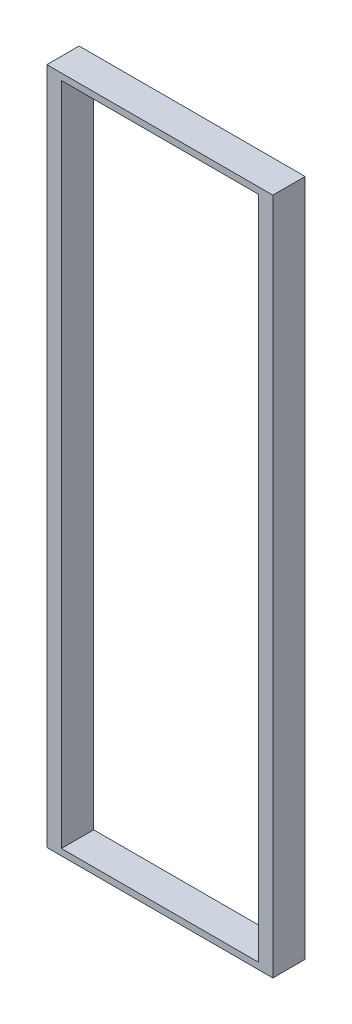
from build123d import *

# Parameters (mm, degrees)
SKETCH_1_W      = 700
SKETCH_1_H      = 2100
SKETCH_1_W_2    = 610
SKETCH_1_H_2    = 2060
EXTRUDE_1_DEPTH = 100


with BuildPart() as part:
    # Эскиз1 → Бобышка-Вытянуть1 (new body)
    with BuildSketch(Plane.XY):
        with Locations((350, 1050)):
            Rectangle(SKETCH_1_W, SKETCH_1_H)
        with Locations((350, 1050)):
            Rectangle(SKETCH_1_W_2, SKETCH_1_H_2, mode=Mode.SUBTRACT)
    extrude(amount=EXTRUDE_1_DEPTH)


solid = part.part
